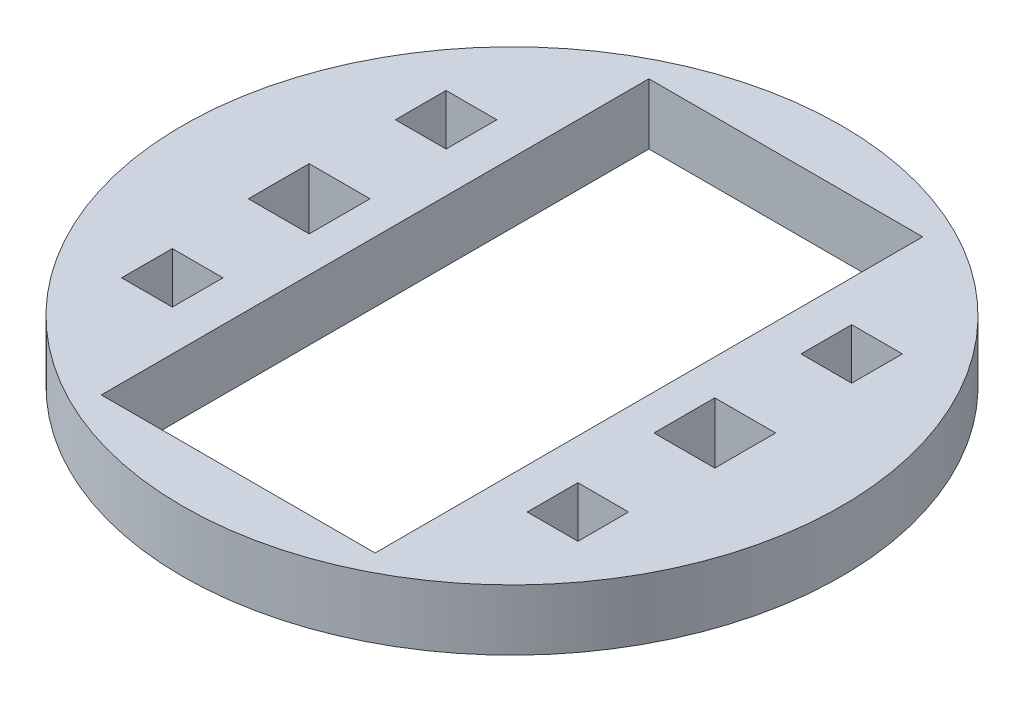
from build123d import *

# Parameters (mm, degrees)
SKETCH1_R               = 32.5
SKETCH1_W               = 6
SKETCH1_H               = 6
SKETCH1_W_2             = 27
SKETCH1_H_2             = 54
BOSS_EXTRUDE1_DEPTH     = 6
CUT_EXTRUDE2_DEPTH      = 47.351914739
CUT_EXTRUDE2_DEPTH_BACK = 47.351914739
SKETCH2_W               = 5
SKETCH2_H               = 5


with BuildPart() as part:
    # Sketch1 → Boss-Extrude1 (new body)
    with BuildSketch(Plane(origin=(0, 0, 0), x_dir=(1, 0, 0), z_dir=(0, 1, 0))):
        with Locations(Location((0, 0, 0), (0, 0, 270))):
            Circle(SKETCH1_R)
        with Locations((-20, 0)):
            Rectangle(SKETCH1_W, SKETCH1_H, mode=Mode.SUBTRACT)
        Rectangle(SKETCH1_W_2, SKETCH1_H_2, mode=Mode.SUBTRACT)
        with Locations((20, 0)):
            Rectangle(SKETCH1_W, SKETCH1_H, mode=Mode.SUBTRACT)
    extrude(amount=BOSS_EXTRUDE1_DEPTH)

    # Sketch2 → Cut-Extrude2 (cut, two sides: drawn at the far end of the back side and taken through both)
    with BuildSketch(Plane(origin=(0, 0, 0), x_dir=(1, 0, 0), z_dir=(0, 1, 0)).offset(-CUT_EXTRUDE2_DEPTH_BACK)):
        with Locations((-20, 13.5)):
            Rectangle(SKETCH2_W, SKETCH2_H)
        with Locations((-20, -13.5)):
            Rectangle(SKETCH2_W, SKETCH2_H)
        with Locations((20, -13.5)):
            Rectangle(SKETCH2_W, SKETCH2_H)
        with Locations((20, 13.5)):
            Rectangle(SKETCH2_W, SKETCH2_H)
    extrude(amount=CUT_EXTRUDE2_DEPTH + CUT_EXTRUDE2_DEPTH_BACK, mode=Mode.SUBTRACT)


solid = part.part
